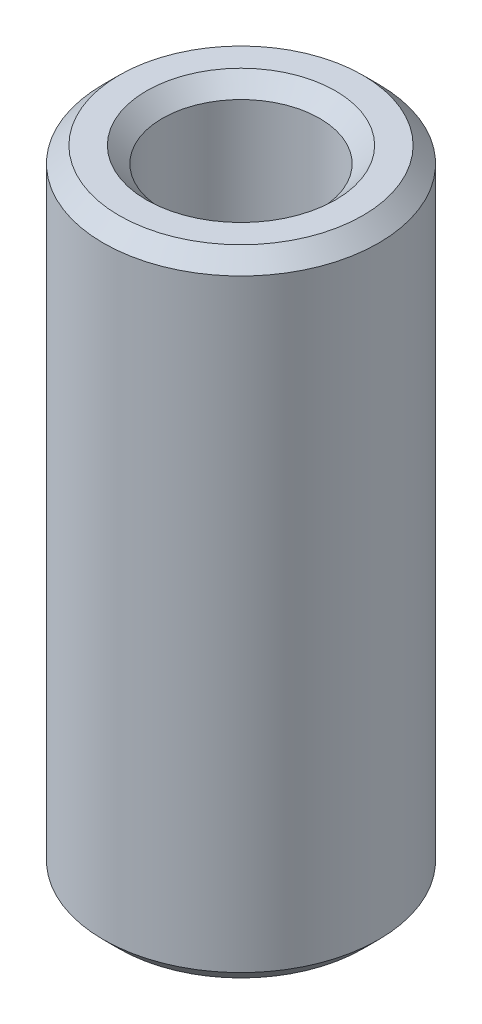
from build123d import *

# Parameters (mm, degrees)
CROQUIS1_R              = 6.5
CROQUIS1_R_2            = 3.715
SALIENTE_EXTRUIR1_DEPTH = 15
CHAFL_N1_SIZE           = 0.75


with BuildPart() as part:
    # Croquis1 → Saliente-Extruir1 (new, symmetric)
    with BuildSketch(Plane(origin=(0, 0, 0), x_dir=(1, 0, 0), z_dir=(0, 1, 0))):
        with Locations(Location((0, 0, 0), (0, 0, 270))):
            Circle(CROQUIS1_R)
        with Locations(Location((0, 0, 0), (0, 0, 270))):
            Circle(CROQUIS1_R_2, mode=Mode.SUBTRACT)
    extrude(amount=SALIENTE_EXTRUIR1_DEPTH, both=True)

    # Chaflán1
    chafl_n1_edges = [part.edges().sort_by_distance(p)[0] for p in [
        (0, -15, -6.5),
        (0, 15, -6.5),
        (0, -15, -3.715),
        (0, 15, -3.715),
    ]]
    chamfer(chafl_n1_edges, length=CHAFL_N1_SIZE)


solid = part.part
